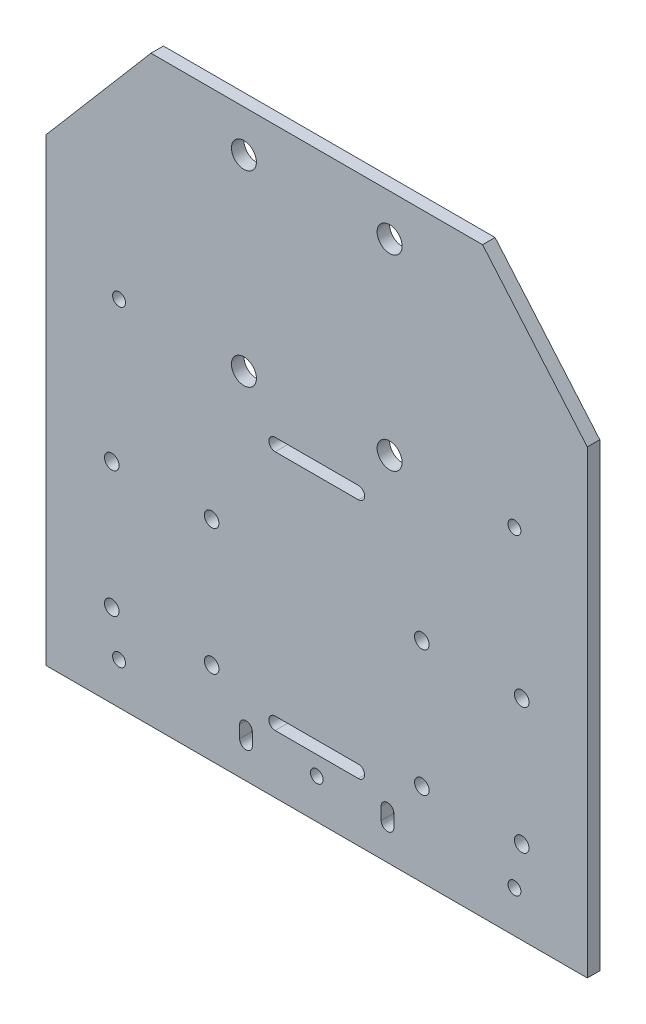
from build123d import *

# Parameters (mm, degrees)
SKETCH_1_R          = 1.75
SKETCH_1_R_2        = 3
EXTRUDE_1_DEPTH     = 3
SKETCH_3_R          = 1.525
CUT_EXTRUDE_2_DEPTH = 10
SKETCH_5_R          = 1.55
CUT_EXTRUDE_3_DEPTH = 10


with BuildPart() as part:
    # 草图1 → 凸台-拉伸1 (new body)
    with BuildSketch(Plane.XY):
        Polygon((65, -25), (65, 75.163369284), (39.840227583, 104.667600302), (-39.840227583, 104.667600302), (-65, 75.163369284), (-65, -25), (-65, -35.332399698), (65, -35.332399698), align=None)
        with Locations((49.25, -15.332399698)):
            Circle(SKETCH_1_R, mode=Mode.SUBTRACT)
        with Locations((25.25, -15.332399698)):
            Circle(SKETCH_1_R, mode=Mode.SUBTRACT)
        with Locations((25.25, 15)):
            Circle(SKETCH_1_R, mode=Mode.SUBTRACT)
        with Locations((49.25, 15)):
            Circle(SKETCH_1_R, mode=Mode.SUBTRACT)
        with Locations(Location((-49.25, 15, 0), (0, 0, 180))):
            Circle(SKETCH_1_R, mode=Mode.SUBTRACT)
        with Locations(Location((-25.25, 15, 0), (0, 0, 180))):
            Circle(SKETCH_1_R, mode=Mode.SUBTRACT)
        with Locations(Location((-25.25, -15.332399698, 0), (0, 0, 180))):
            Circle(SKETCH_1_R, mode=Mode.SUBTRACT)
        with Locations(Location((-49.25, -15.332399698, 0), (0, 0, 180))):
            Circle(SKETCH_1_R, mode=Mode.SUBTRACT)
        with Locations((-17.5, 94.667600302)):
            Circle(SKETCH_1_R_2, mode=Mode.SUBTRACT)
        with Locations(Location((17.5, 94.667600302, 0), (0, 0, 180))):
            Circle(SKETCH_1_R_2, mode=Mode.SUBTRACT)
        with Locations((-17.5, 49.667600302)):
            Circle(SKETCH_1_R_2, mode=Mode.SUBTRACT)
        with Locations(Location((17.5, 49.667600302, 0), (0, 0, 180))):
            Circle(SKETCH_1_R_2, mode=Mode.SUBTRACT)
        with BuildLine():
            Line((-10, 39.667600302), (10, 39.667600302))
            ThreePointArc((10, 39.667600302), (11.5, 38.167600302), (10, 36.667600302))
            Line((10, 36.667600302), (-10, 36.667600302))
            ThreePointArc((-10, 36.667600302), (-11.5, 38.167600302), (-10, 39.667600302))
        make_face(mode=Mode.SUBTRACT)
        with BuildLine():
            Line((-10, -18.332399698), (10, -18.332399698))
            ThreePointArc((10, -18.332399698), (11.5, -19.832399698), (10, -21.332399698))
            Line((10, -21.332399698), (-10, -21.332399698))
            ThreePointArc((-10, -21.332399698), (-11.5, -19.832399698), (-10, -18.332399698))
        make_face(mode=Mode.SUBTRACT)
    extrude(amount=EXTRUDE_1_DEPTH)

    # 草图3 → 切除-拉伸2 (cut)
    with BuildSketch(Plane(origin=(0, 0, 0), x_dir=(-1, 0, 0), z_dir=(0, 0, -1))):
        with Locations((0, -25.832399698)):
            Circle(SKETCH_3_R)
        with BuildLine():
            Line((-18.52, -27.332399698), (-18.52, -24.332399698))
            ThreePointArc((-18.52, -24.332399698), (-17, -22.812399698), (-15.48, -24.332399698))
            Line((-15.48, -24.332399698), (-15.48, -27.332399698))
            ThreePointArc((-15.48, -27.332399698), (-17, -28.852399698), (-18.52, -27.332399698))
        make_face()
        with BuildLine():
            Line((18.52, -27.332399698), (18.52, -24.332399698))
            ThreePointArc((18.52, -24.332399698), (17, -22.812399698), (15.48, -24.332399698))
            Line((15.48, -24.332399698), (15.48, -27.332399698))
            ThreePointArc((15.48, -27.332399698), (17, -28.852399698), (18.52, -27.332399698))
        make_face()
    extrude(amount=-CUT_EXTRUDE_2_DEPTH, mode=Mode.SUBTRACT)

    # 草图5 → 切除-拉伸3 (cut)
    with BuildSketch(Plane.XY.offset(3)):
        with Locations((-47.5, 49.667600302)):
            Circle(SKETCH_5_R)
        with Locations((47.5, 49.667600302)):
            Circle(SKETCH_5_R)
        with Locations((-47.5, -25.332399698)):
            Circle(SKETCH_5_R)
        with Locations((47.5, -25.332399698)):
            Circle(SKETCH_5_R)
    extrude(amount=-CUT_EXTRUDE_3_DEPTH, mode=Mode.SUBTRACT)


solid = part.part
